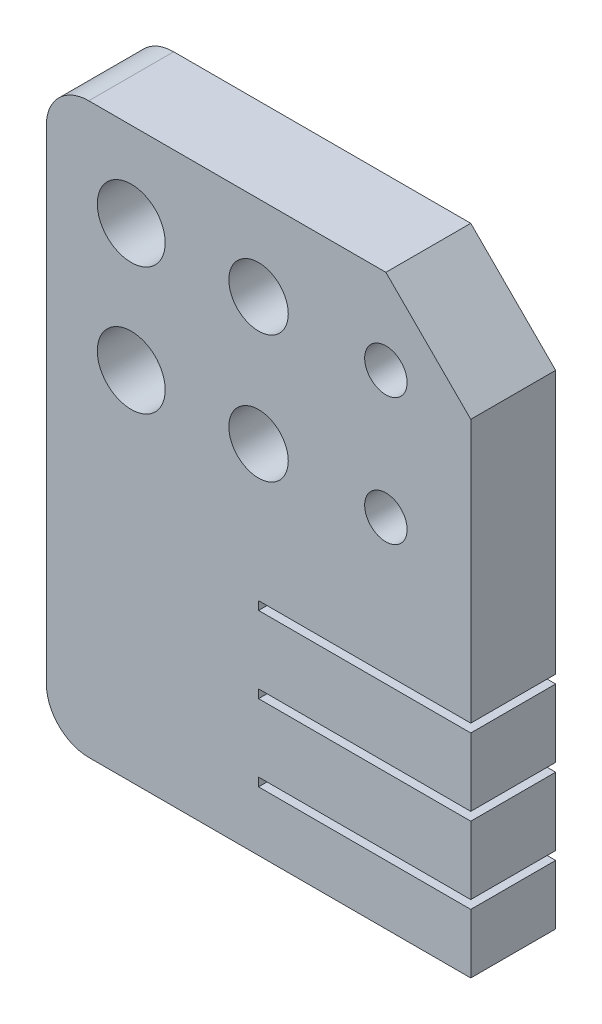
from build123d import *

# Parameters (mm, degrees)
SKETCH1_R           = 4
SKETCH1_R_2         = 3.5
SKETCH1_R_3         = 2.5
BOSS_EXTRUDE1_DEPTH = 10
SKETCH2_W           = 25
SKETCH2_H           = 1
CUT_EXTRUDE1_DEPTH  = 10


with BuildPart() as part:
    # Sketch1 → Boss-Extrude1 (new body)
    with BuildSketch(Plane.XY):
        with BuildLine():
            Line((40, 67), (50, 57))
            Line((50, 57), (50, 0))
            Line((50, 0), (5, 0))
            ThreePointArc((5, 0), (1.464466094, 1.464466094), (0, 5))
            Line((0, 5), (0, 62))
            ThreePointArc((0, 62), (1.464466094, 65.535533906), (5, 67))
            Line((5, 67), (40, 67))
        make_face()
        with Locations((10, 57)):
            Circle(SKETCH1_R, mode=Mode.SUBTRACT)
        with Locations((25, 57)):
            Circle(SKETCH1_R_2, mode=Mode.SUBTRACT)
        with Locations((40, 57)):
            Circle(SKETCH1_R_3, mode=Mode.SUBTRACT)
        with Locations((10, 42)):
            Circle(SKETCH1_R, mode=Mode.SUBTRACT)
        with Locations((25, 42)):
            Circle(SKETCH1_R_2, mode=Mode.SUBTRACT)
        with Locations((40, 42)):
            Circle(SKETCH1_R_3, mode=Mode.SUBTRACT)
    extrude(amount=BOSS_EXTRUDE1_DEPTH)

    # Sketch2 → Cut-Extrude1 (cut)
    with BuildSketch(Plane.XY.offset(10)):
        with Locations((37.5, 25.5)):
            Rectangle(SKETCH2_W, SKETCH2_H)
        with Locations((37.5, 16.5)):
            Rectangle(SKETCH2_W, SKETCH2_H)
        with Locations((37.5, 7.5)):
            Rectangle(SKETCH2_W, SKETCH2_H)
    extrude(amount=-CUT_EXTRUDE1_DEPTH, mode=Mode.SUBTRACT)


solid = part.part
